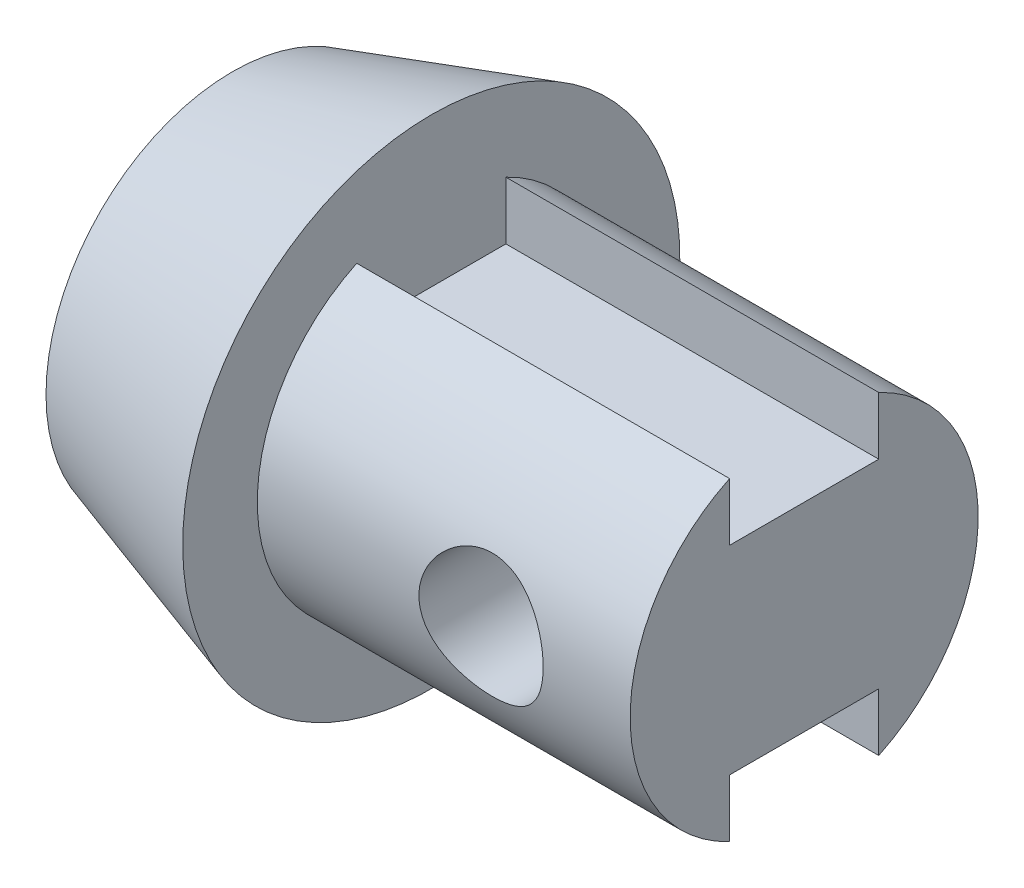
from build123d import *

# Parameters (mm, degrees)
CUT_EXTRUDE1_DEPTH      = 28
CUT_EXTRUDE1_DEPTH_BACK = 15
CUT_EXTRUDE2_DEPTH      = 28
CUT_EXTRUDE2_DEPTH_BACK = 28
SKETCH3_R               = 2.5


with BuildPart() as part:
    # Sketch1 → Revolve1 (revolve)
    with BuildSketch(Plane(origin=(0, 0, 0), x_dir=(0, 1, 0), z_dir=(0, 0, 1))):
        Polygon((0, 0), (7.5, 0), (10, -8), (7, -8), (7, -23), (0, -23), align=None)
    revolve(axis=Axis((23, 0, 0), (-1, 0, 0)))

    # Sketch2 → Cut-Extrude1 (cut, two sides: drawn at the far end of the back side and taken through both)
    with BuildSketch(Plane.YZ.offset(23).offset(-CUT_EXTRUDE1_DEPTH_BACK)):
        with BuildLine():
            ThreePointArc((7, 0), (6.829051444, 1.537548822), (6.32455532, 3))
            Line((6.32455532, 3), (4, 3))
            Line((4, 3), (4, -3))
            Line((4, -3), (6.32455532, -3))
            ThreePointArc((6.32455532, -3), (6.829051444, -1.537548822), (7, 0))
        make_face()
        with BuildLine():
            Line((-4, 3), (-6.32455532, 3))
            ThreePointArc((-6.32455532, 3), (-6.829051444, 1.537548822), (-7, 0))
            ThreePointArc((-7, 0), (-6.829051444, -1.537548822), (-6.32455532, -3))
            Line((-6.32455532, -3), (-4, -3))
            Line((-4, -3), (-4, 3))
        make_face()
    extrude(amount=CUT_EXTRUDE1_DEPTH + CUT_EXTRUDE1_DEPTH_BACK, mode=Mode.SUBTRACT)

    # Sketch3 → Cut-Extrude2 (cut, two sides: drawn at the far end of the back side and taken through both)
    with BuildSketch(Plane(origin=(0, 0, 0), x_dir=(0, 1, 0), z_dir=(0, 0, 1)).offset(-CUT_EXTRUDE2_DEPTH_BACK)):
        with Locations(Location((0, -17, 0), (0, 0, 270))):
            Circle(SKETCH3_R)
    extrude(amount=CUT_EXTRUDE2_DEPTH + CUT_EXTRUDE2_DEPTH_BACK, mode=Mode.SUBTRACT)


solid = part.part
